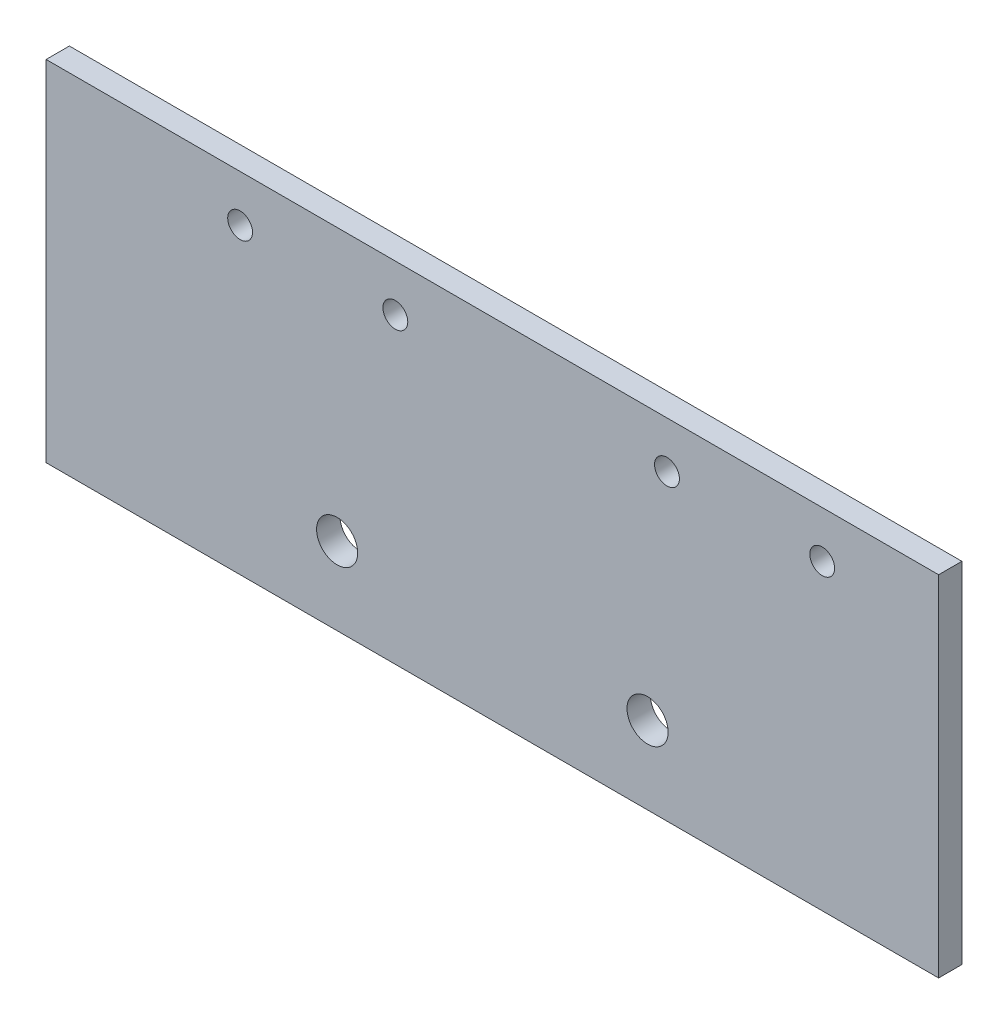
from build123d import *

# Parameters (mm, degrees)
SKETCH_1_W          = 75
SKETCH_1_H          = 45
SKETCH_1_R          = 2.65
EXTRUDE_1_DEPTH     = 3
SKETCH_2_W          = 20
SKETCH_2_H          = 45
EXTRUDE_2_DEPTH     = 3
SKETCH_3_R          = 1.6
CUT_EXTRUDE_1_DEPTH = 3
SKETCH_4_W          = 20
SKETCH_4_H          = 45
EXTRUDE_3_DEPTH     = 3


with BuildPart() as part:
    # 草图1 → 凸台-拉伸1 (new body)
    with BuildSketch(Plane.XY):
        with Locations((-219.5, 22.5)):
            Rectangle(SKETCH_1_W, SKETCH_1_H)
        with Locations((-239.5, 10)):
            Circle(SKETCH_1_R, mode=Mode.SUBTRACT)
        with Locations(Location((-199.5, 10, 0), (0, 0, 180))):
            Circle(SKETCH_1_R, mode=Mode.SUBTRACT)
    extrude(amount=EXTRUDE_1_DEPTH)

    # 草图2 → 凸台-拉伸2 (add)
    with BuildSketch(Plane.XY.offset(3)):
        with Locations((-172, 22.5)):
            Rectangle(SKETCH_2_W, SKETCH_2_H)
    extrude(amount=-EXTRUDE_2_DEPTH)

    # 草图3 → 切除-拉伸1 (cut)
    with BuildSketch(Plane.XY.offset(3)):
        with Locations((-197, 39)):
            Circle(SKETCH_3_R)
        with Locations((-177, 39)):
            Circle(SKETCH_3_R)
        with Locations((-232, 39)):
            Circle(SKETCH_3_R)
        with Locations((-252, 39)):
            Circle(SKETCH_3_R)
    extrude(amount=-CUT_EXTRUDE_1_DEPTH, mode=Mode.SUBTRACT)

    # 草图4 → 凸台-拉伸3 (add)
    with BuildSketch(Plane.XY.offset(3)):
        with Locations((-267, 22.5)):
            Rectangle(SKETCH_4_W, SKETCH_4_H)
    extrude(amount=-EXTRUDE_3_DEPTH)


solid = part.part
